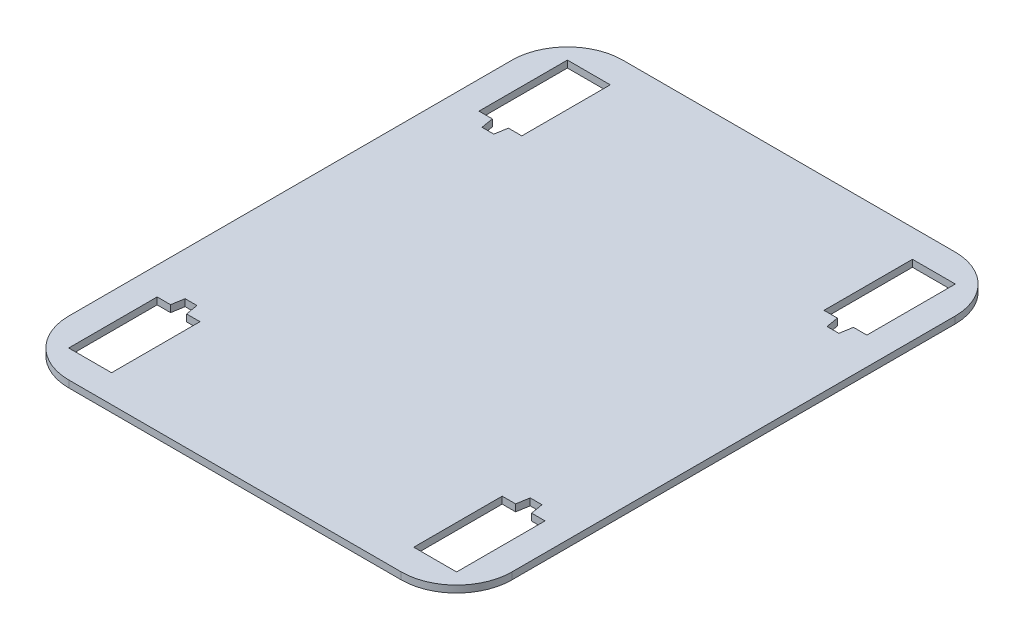
from build123d import *

# Parameters (mm, degrees)
SKETCH1_W               = 203.2
SKETCH1_H               = 254
BOSS_EXTRUDE1_DEPTH     = 3.175
FILLET1_R               = 25.4
SKETCH2_W               = 19.6508
SKETCH2_H               = 40.550799923
CUT_EXTRUDE1_DEPTH      = 163.67034341
CUT_EXTRUDE2_DEPTH      = 163.67034341
MIRROR2_COPY_1_SKETCH_W = 19.6508
MIRROR2_COPY_1_SKETCH_H = 40.550799923
MIRROR2_COPY_1_DEPTH    = 163.67034341
MIRROR2_COPY_2_DEPTH    = 163.67034341


with BuildPart() as part:
    # Sketch1 → Boss-Extrude1 (new body)
    with BuildSketch(Plane(origin=(0, 0, 0), x_dir=(1, 0, 0), z_dir=(0, 1, 0))):
        Rectangle(SKETCH1_W, SKETCH1_H)
    extrude(amount=BOSS_EXTRUDE1_DEPTH)

    # Fillet1
    fillet1_edges = [part.edges().sort_by_distance(p)[0] for p in [
        (101.6, 1.5875, 127),
        (-101.6, 1.5875, 127),
        (-101.6, 1.5875, -127),
        (101.6, 1.5875, -127),
    ]]
    fillet(fillet1_edges, radius=FILLET1_R)

    # Sketch2 → Cut-Extrude1 (cut, through all)
    with BuildSketch(Plane(origin=(0, 3.175, 0), x_dir=(1, 0, 0), z_dir=(0, 1, 0))):
        with Locations((-79.1, 94.050000013)):
            Rectangle(SKETCH2_W, SKETCH2_H)
    cut_extrude1 = extrude(amount=-CUT_EXTRUDE1_DEPTH, mode=Mode.SUBTRACT)

    # Sketch3 → Cut-Extrude2 (cut, through all)
    with BuildSketch(Plane.XZ):
        Polygon((-82.775820479, -73.774600051), (-81.815035673, -68.053121226), (-76.384964327, -68.053121226), (-75.424179521, -73.774600051), align=None)
    cut_extrude2 = extrude(amount=-CUT_EXTRUDE2_DEPTH, mode=Mode.SUBTRACT)

    # Mirror1: Cut-Extrude1, Cut-Extrude2 across plane
    add(cut_extrude1.mirror(Plane(origin=(0, 0, 0), x_dir=(0, 0, 1), z_dir=(1, 0, 0))), mode=Mode.SUBTRACT)
    add(cut_extrude2.mirror(Plane(origin=(0, 0, 0), x_dir=(0, 0, 1), z_dir=(1, 0, 0))), mode=Mode.SUBTRACT)

    # Mirror2: Cut-Extrude1, Cut-Extrude2 across plane
    add(cut_extrude1.mirror(Plane.XY), mode=Mode.SUBTRACT)
    add(cut_extrude2.mirror(Plane.XY), mode=Mode.SUBTRACT)

    # Mirror2 copy 1 sketch → Mirror2 copy 1 (cut, through all)
    with BuildSketch(Plane(origin=(0, 3.175, 0), x_dir=(-1, 0, 0), z_dir=(0, 1, 0))):
        with Locations((-79.1, 94.050000013)):
            Rectangle(MIRROR2_COPY_1_SKETCH_W, MIRROR2_COPY_1_SKETCH_H)
    extrude(amount=-MIRROR2_COPY_1_DEPTH, mode=Mode.SUBTRACT)

    # Mirror2 copy 2 sketch → Mirror2 copy 2 (cut, through all)
    with BuildSketch(Plane(origin=(0, 0, 0), x_dir=(-1, 0, 0), z_dir=(0, -1, 0))):
        Polygon((-82.775820479, -73.774600051), (-81.815035673, -68.053121226), (-76.384964327, -68.053121226), (-75.424179521, -73.774600051), align=None)
    extrude(amount=-MIRROR2_COPY_2_DEPTH, mode=Mode.SUBTRACT)


solid = part.part
